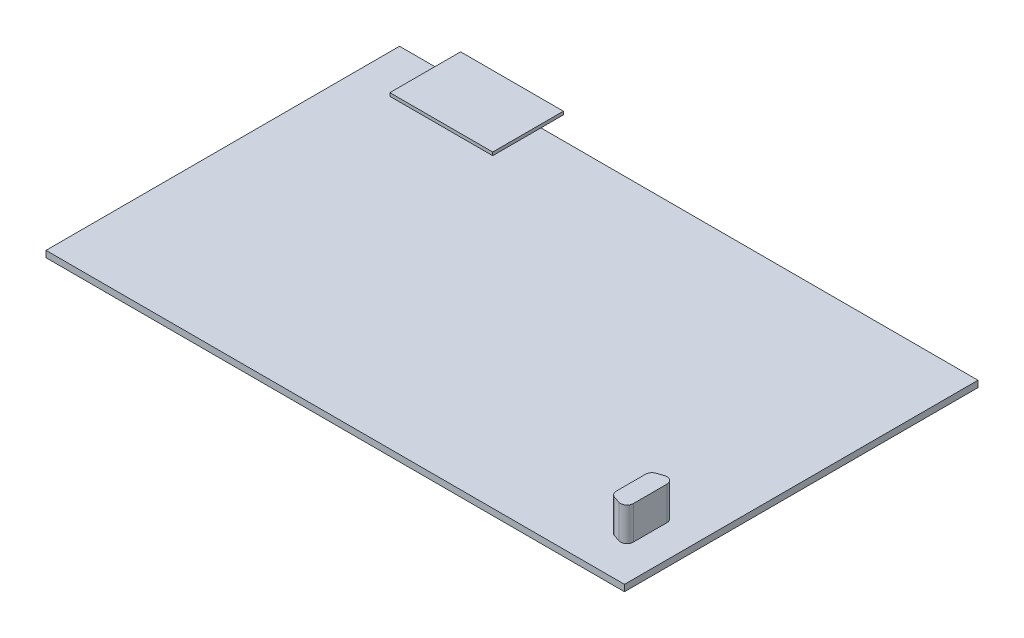
from build123d import *

# Parameters (mm, degrees)
SKETCH4_W           = 228.6
SKETCH4_H           = 139.7
BOSS_EXTRUDE3_DEPTH = 2.54
SKETCH5_W           = 33.02
SKETCH5_H           = 5.08
BOSS_EXTRUDE4_DEPTH = 2.54
SKETCH6_W           = 40.64
SKETCH6_H           = 27.94
BOSS_EXTRUDE5_DEPTH = 1.27
BOSS_EXTRUDE7_DEPTH = 13.208
FILLET1_R           = 2.54


with BuildPart() as part:
    # Sketch4 → Boss-Extrude3 (new body)
    with BuildSketch(Plane(origin=(0, 0, 0), x_dir=(1, 0, 0), z_dir=(0, 1, 0))):
        with Locations((133.35, 88.9)):
            Rectangle(SKETCH4_W, SKETCH4_H)
    extrude(amount=BOSS_EXTRUDE3_DEPTH)

    # Sketch5 → Boss-Extrude4 (add)
    with BuildSketch(Plane(origin=(0, 2.54, 0), x_dir=(1, 0, 0), z_dir=(0, 1, 0))):
        with Locations((57.15, 146.05)):
            Rectangle(SKETCH5_W, SKETCH5_H)
    extrude(amount=BOSS_EXTRUDE4_DEPTH)

    # Sketch6 → Boss-Extrude5 (add)
    with BuildSketch(Plane(origin=(0, 5.08, 0), x_dir=(1, 0, 0), z_dir=(0, 1, 0))):
        with Locations((57.15, 151.13)):
            Rectangle(SKETCH6_W, SKETCH6_H)
    extrude(amount=BOSS_EXTRUDE5_DEPTH)

    # Sketch8 → Boss-Extrude7 (add)
    with BuildSketch(Plane(origin=(0, 2.54, 0), x_dir=(1, 0, 0), z_dir=(0, 1, 0))):
        Polygon((227.33, 49.53), (234.95, 52.07), (234.95, 31.75), (227.33, 34.29), align=None)
    extrude(amount=BOSS_EXTRUDE7_DEPTH)

    # Fillet1
    fillet1_edges = [part.edges().sort_by_distance(p)[0] for p in [
        (227.33, 9.144, -49.53),
        (227.33, 9.144, -34.29),
        (234.95, 9.144, -31.75),
        (234.95, 9.144, -52.07),
    ]]
    fillet(fillet1_edges, radius=FILLET1_R)


solid = part.part
